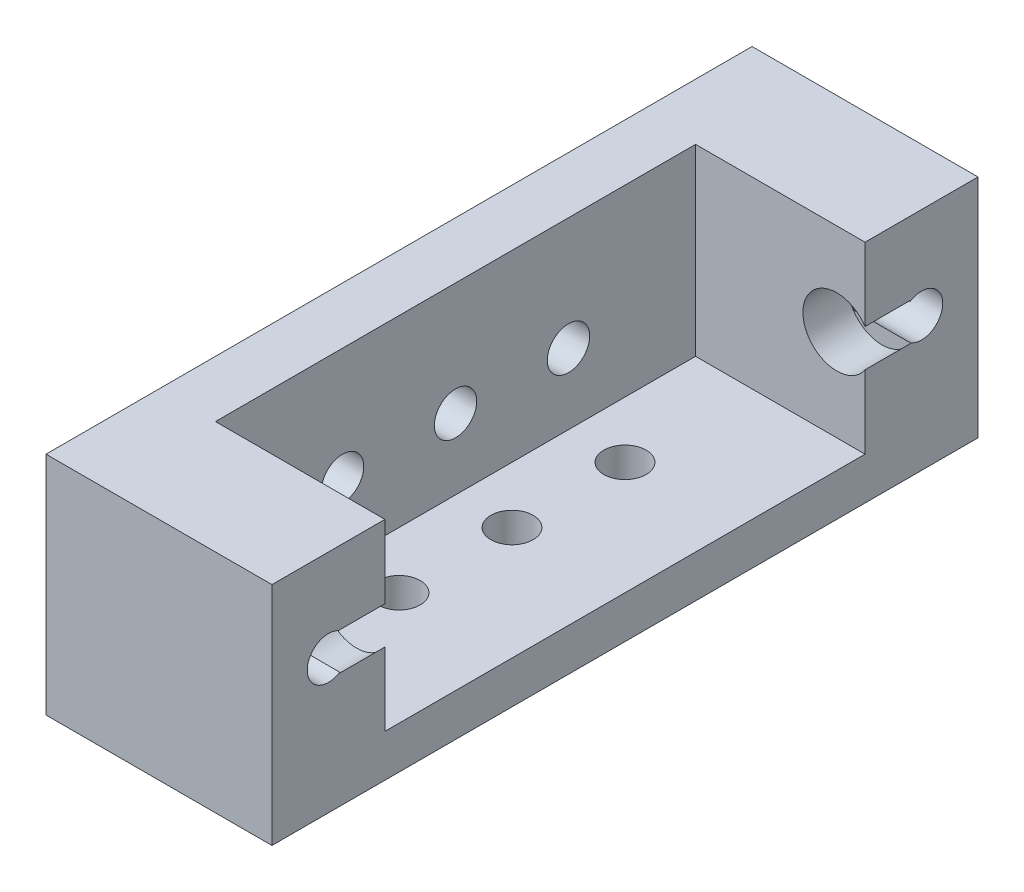
from build123d import *

# Parameters (mm, degrees)
SKETCH1_W               = 25.4
SKETCH1_H               = 25.4
BOSS_EXTRUDE1_DEPTH     = 79.375
SKETCH2_W               = 19.05
SKETCH2_H               = 53.975
CUT_EXTRUDE1_DEPTH      = 20.6375
CUT_EXTRUDE2_DEPTH      = 88.124684361
CUT_EXTRUDE2_DEPTH_BACK = 88.124684361
SKETCH3_R               = 2.38125
CUT_EXTRUDE3_DEPTH      = 88.124684361
CUT_EXTRUDE3_DEPTH_BACK = 88.124684361
SKETCH4_R               = 2.38125
CUT_EXTRUDE4_DEPTH      = 59.055
CUT_EXTRUDE4_DEPTH_BACK = 5.08
SKETCH6_R               = 3.81
SKETCH8_R               = 2.38125
CUT_EXTRUDE5_DEPTH      = 6.35


with BuildPart() as part:
    # Sketch1 → Boss-Extrude1 (new body)
    with BuildSketch(Plane.XY):
        with Locations((12.7, 12.7)):
            Rectangle(SKETCH1_W, SKETCH1_H)
    extrude(amount=BOSS_EXTRUDE1_DEPTH)

    # Sketch2 → Cut-Extrude1 (cut)
    with BuildSketch(Plane(origin=(0, 25.4, 0), x_dir=(1, 0, 0), z_dir=(0, 1, 0))):
        with Locations((15.875, -39.6875)):
            Rectangle(SKETCH2_W, SKETCH2_H)
    extrude(amount=-CUT_EXTRUDE1_DEPTH, mode=Mode.SUBTRACT)

    # Sketch3 → Cut-Extrude2 (cut, two sides: drawn at the far end of the back side and taken through both)
    with BuildSketch(Plane.ZY.offset(-CUT_EXTRUDE2_DEPTH_BACK)):
        with Locations((26.9875, 12.7)):
            Circle(SKETCH3_R)
        with Locations((39.6875, 12.7)):
            Circle(SKETCH3_R)
        with Locations((52.3875, 12.7)):
            Circle(SKETCH3_R)
    extrude(amount=CUT_EXTRUDE2_DEPTH + CUT_EXTRUDE2_DEPTH_BACK, mode=Mode.SUBTRACT)

    # Sketch4 → Cut-Extrude3 (cut, two sides: drawn at the far end of the back side and taken through both)
    with BuildSketch(Plane.XZ.offset(-CUT_EXTRUDE3_DEPTH_BACK)):
        with Locations(Location((12.7, 52.3875, 0), (0, 0, 270))):
            Circle(SKETCH4_R)
        with Locations(Location((12.7, 39.6875, 0), (0, 0, 270))):
            Circle(SKETCH4_R)
        with Locations(Location((12.7, 26.9875, 0), (0, 0, 270))):
            Circle(SKETCH4_R)
    extrude(amount=CUT_EXTRUDE3_DEPTH + CUT_EXTRUDE3_DEPTH_BACK, mode=Mode.SUBTRACT)

    # Sketch6 → Cut-Extrude4 (cut, two sides: drawn at the far end of the back side and taken through both)
    with BuildSketch(Plane.XY.offset(12.7).offset(-CUT_EXTRUDE4_DEPTH_BACK)):
        with Locations((22.225, 15.08125)):
            Circle(SKETCH6_R)
    extrude(amount=CUT_EXTRUDE4_DEPTH + CUT_EXTRUDE4_DEPTH_BACK, mode=Mode.SUBTRACT)

    # Sketch8 → Cut-Extrude5 (cut)
    with BuildSketch(Plane(origin=(25.4, 0, 0), x_dir=(0, 0, -1), z_dir=(1, 0, 0))):
        with Locations((-73.025, 15.08125)):
            Circle(SKETCH8_R)
        with Locations((-6.35, 15.08125)):
            Circle(SKETCH8_R)
    extrude(amount=-CUT_EXTRUDE5_DEPTH, mode=Mode.SUBTRACT)


solid = part.part
